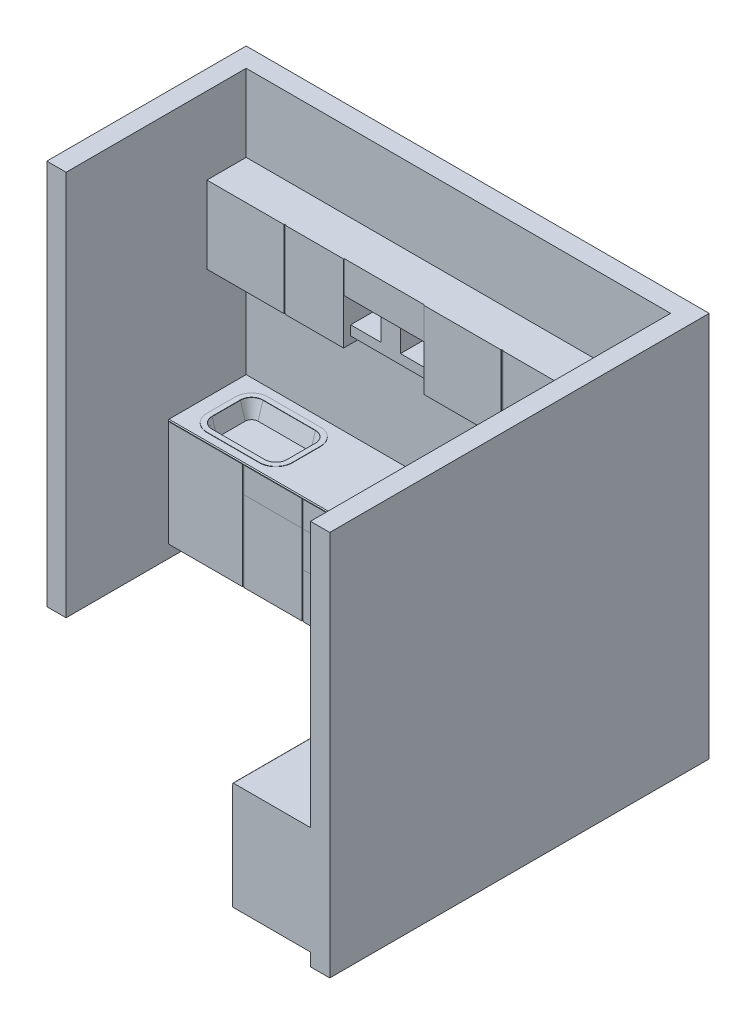
from build123d import *

# Parameters (mm, degrees)
BOSS_EXTRUDE1_DEPTH   = 3048
BOSS_EXTRUDE2_START   = 101.6
BOSS_EXTRUDE2_DEPTH   = 838.2
SKETCH5_W             = 584.2
SKETCH5_H             = 838.2
SKETCH5_W_2           = 457.2
SKETCH5_W_3           = 609.6
SKETCH5_W_4           = 431.8
BOSS_EXTRUDE3_DEPTH   = 5.08
SKETCH10_W            = 457.2
SKETCH10_H            = 838.2
SKETCH10_W_2          = 152.4
SKETCH10_W_3          = 596.9
SKETCH10_W_4          = 515.62
BOSS_EXTRUDE4_DEPTH   = 5.08
BOSS_EXTRUDE5_START   = 1828.8
BOSS_EXTRUDE5_DEPTH   = 609.6
SKETCH12_W            = 609.6
SKETCH12_H            = 609.6
SKETCH12_W_2          = 457.2
SKETCH12_W_3          = 711.2
BOSS_EXTRUDE6_DEPTH   = 5.08
SKETCH13_W            = 635
SKETCH13_H            = 356.096937619
CUT_EXTRUDE2_DEPTH    = 304.8
BOSS_EXTRUDE7_DEPTH   = 254
SKETCH15_W            = 304.8
SKETCH15_H            = 609.6
CUT_EXTRUDE3_DEPTH    = 2844.8
SKETCH16_W            = 609.6
SKETCH16_H            = 609.6
CUT_EXTRUDE4_DEPTH    = 2844.8
BOSS_EXTRUDE8_REACH   = 3432.787
SKETCH17_W            = 609.6
SKETCH17_H            = 457.2
SKETCH18_W            = 558.8
SKETCH18_H            = 1435.1
CUT_EXTRUDE5_DEPTH    = 406.4
SKETCH19_W            = 558.8
SKETCH19_H            = 2.54
EXTRUDE_THIN1_DEPTH   = 355.6
EXTRUDE_THIN1_2_DEPTH = 355.6
BOSS_EXTRUDE9_START   = 25.4
SKETCH20_W            = 558.8
SKETCH20_H            = 1435.1
BOSS_EXTRUDE9_DEPTH   = 25.4
CUT_EXTRUDE6_DEPTH    = 124.46
CUT_EXTRUDE6_DRAFT    = -17
BOSS_EXTRUDE10_DEPTH  = 2.54


with BuildPart() as part:
    # Sketch1 → Boss-Extrude1 (new body)
    with BuildSketch(Plane(origin=(0, 0, 0), x_dir=(1, 0, 0), z_dir=(0, 1, 0))):
        Polygon((-1828.8, 0), (-1828.8, 1574.8), (1828.8, 1574.8), (1828.8, -1422.4), (1676.4, -1422.4), (1676.4, 1422.4), (-1676.4, 1422.4), (-1676.4, 0), align=None)
    extrude(amount=BOSS_EXTRUDE1_DEPTH)



with BuildPart() as body_2:
    # Sketch2 → Boss-Extrude2 (new body)
    with BuildSketch(Plane(origin=(0, 0, 0), x_dir=(1, 0, 0), z_dir=(0, 1, 0)).offset(BOSS_EXTRUDE2_START)):
        Polygon((1676.4, 1422.4), (1676.4, -1422.4), (1066.8, -1422.4), (1066.8, 812.8), (-1676.4, 812.8), (-1676.4, 1422.4), align=None)
    extrude(amount=BOSS_EXTRUDE2_DEPTH)


with BuildPart() as part_1:
    add(part.part)

    add(body_2.part)  # Sweep2 merges body 2
    # Sweep2: sweep along a path in Sketch3
    with BuildLine(Plane(origin=(0, 939.8, 0), x_dir=(1, 0, 0), z_dir=(0, 1, 0))) as sweep2_path:
        Line((1066.8, -1422.4), (1066.8, 812.8))
        Line((1066.8, 812.8), (-1676.4, 812.8))
    # Sketch4 → Sweep2 (sweep)
    with BuildSketch(Plane.XY.offset(1422.4)):
        with BuildLine():
            Line((1676.4, 939.8), (1066.8, 939.8))
            ThreePointArc((1066.8, 939.8), (1062.043473448, 946.15), (1066.8, 952.5))
            Line((1066.8, 952.5), (1676.4, 952.5))
            Line((1676.4, 952.5), (1676.4, 939.8))
        make_face()
    sweep(path=sweep2_path.line, transition=Transition.RIGHT)

    # Sketch5 → Boss-Extrude3 (add)
    with BuildSketch(Plane.XY.offset(-812.8)):
        with Locations((-1384.3, 520.7)):
            Rectangle(SKETCH5_W, SKETCH5_H)
        with Locations((-850.9, 520.7)):
            Rectangle(SKETCH5_W_2, SKETCH5_H)
        with Locations((-304.8, 520.7)):
            Rectangle(SKETCH5_W_3, SKETCH5_H)
        with Locations((762, 520.7)):
            Rectangle(SKETCH5_W_3, SKETCH5_H)
        with Locations((228.6, 520.7)):
            Rectangle(SKETCH5_W_4, SKETCH5_H)
    extrude(amount=BOSS_EXTRUDE3_DEPTH)

    # Sketch10 → Boss-Extrude4 (add)
    with BuildSketch(Plane.ZY.offset(-1066.8)):
        with Locations((-579.12, 520.7)):
            Rectangle(SKETCH10_W, SKETCH10_H)
        with Locations((-261.62, 520.7)):
            Rectangle(SKETCH10_W_2, SKETCH10_H)
        with Locations((125.73, 520.7)):
            Rectangle(SKETCH10_W_3, SKETCH10_H)
        with Locations((1164.59, 520.7)):
            Rectangle(SKETCH10_W_4, SKETCH10_H)
        with Locations((665.48, 520.7)):
            Rectangle(SKETCH10_W, SKETCH10_H)
    extrude(amount=BOSS_EXTRUDE4_DEPTH)

    # Sketch11 → Boss-Extrude5 (add)
    with BuildSketch(Plane(origin=(0, 0, 0), x_dir=(1, 0, 0), z_dir=(0, 1, 0)).offset(BOSS_EXTRUDE5_START)):
        Polygon((1676.4, 1422.4), (1676.4, -1422.4), (1371.6, -1422.4), (1371.6, 1117.6), (-1676.4, 1117.6), (-1676.4, 1422.4), align=None)
    extrude(amount=BOSS_EXTRUDE5_DEPTH)

    # Sketch12 → Boss-Extrude6 (add)
    with BuildSketch(Plane.XY.offset(-1117.6)):
        with Locations((-1371.6, 2133.6)):
            Rectangle(SKETCH12_W, SKETCH12_H)
        with Locations((-825.5, 2133.6)):
            Rectangle(SKETCH12_W_2, SKETCH12_H)
        with Locations((342.9, 2133.6)):
            Rectangle(SKETCH12_W, SKETCH12_H)
        with Locations((1016, 2133.6)):
            Rectangle(SKETCH12_W_3, SKETCH12_H)
    extrude(amount=BOSS_EXTRUDE6_DEPTH)

    # Sketch13 → Cut-Extrude2 (cut)
    with BuildSketch(Plane.XY.offset(-1117.6)):
        with Locations((-279.4, 2006.84846881)):
            Rectangle(SKETCH13_W, SKETCH13_H)
    extrude(amount=-CUT_EXTRUDE2_DEPTH, mode=Mode.SUBTRACT)

    # Sketch15 → Cut-Extrude3 (cut)
    with BuildSketch(Plane.XY.offset(1422.4)):
        with Locations((1524, 2133.6)):
            Rectangle(SKETCH15_W, SKETCH15_H)
    extrude(amount=-CUT_EXTRUDE3_DEPTH, mode=Mode.SUBTRACT)

    # Sketch16 → Cut-Extrude4 (cut)
    with BuildSketch(Plane(origin=(0, 952.5, 0), x_dir=(1, 0, 0), z_dir=(0, 1, 0))):
        with Locations((1371.6, 1117.6)):
            Rectangle(SKETCH16_W, SKETCH16_H)
    extrude(amount=CUT_EXTRUDE4_DEPTH, mode=Mode.SUBTRACT)


with BuildPart() as body_2_2:
    # Sketch14 → Boss-Extrude7 (new body)
    with BuildSketch(Plane.XY.offset(-1422.4)):
        Polygon((-355.6, 2184.896937619), (-203.2, 2184.896937619), (-203.2, 1959.906980292), (38.1, 1959.906980292), (38.1, 1883.706980292), (-596.9, 1883.706980292), (-596.9, 1959.906980292), (-355.6, 1959.906980292), align=None)
    extrude(amount=BOSS_EXTRUDE7_DEPTH)


with BuildPart() as body_3:

    # Sketch17 → Boss-Extrude8 (new, up to next)
    with BuildSketch(Plane(origin=(0, 2438.4, 0), x_dir=(1, 0, 0), z_dir=(0, 1, 0)), mode=Mode.PRIVATE) as boss_extrude8_sk1:
        with Locations((1371.6, 1193.8)):
            Rectangle(SKETCH17_W, SKETCH17_H)
    boss_extrude8_tool1 = extrude(boss_extrude8_sk1.sketch, amount=-BOSS_EXTRUDE8_REACH, mode=Mode.PRIVATE) - part_1.part
    add(boss_extrude8_tool1.solids().sort_by_distance((1371.6, 2438.4, -1193.8))[0])

    # Sketch18 → Cut-Extrude5 (cut)
    with BuildSketch(Plane.XY.offset(-965.2)):
        with Locations((1371.6, 1695.45)):
            Rectangle(SKETCH18_W, SKETCH18_H)
    extrude(amount=-CUT_EXTRUDE5_DEPTH, mode=Mode.SUBTRACT)


with BuildPart() as body_4:
    # Sketch19 → Extrude-Thin1 (new body)
    with BuildSketch(Plane.XY.offset(-1371.6)):
        with Locations((1371.6, 1694.18)):
            Rectangle(SKETCH19_W, SKETCH19_H)
    extrude(amount=EXTRUDE_THIN1_DEPTH)


with BuildPart() as body_5:
    # Sketch19 → Extrude-Thin1 2 (new body)
    with BuildSketch(Plane.XY.offset(-1371.6)):
        with Locations((1371.6, 1377.976430218)):
            Rectangle(SKETCH19_W, SKETCH19_H)
    extrude(amount=EXTRUDE_THIN1_2_DEPTH)


with BuildPart() as body_6:
    # Sketch20 → Boss-Extrude9 (new body)
    with BuildSketch(Plane.XY.offset(-1016).offset(BOSS_EXTRUDE9_START)):
        with Locations((1371.6, 1695.45)):
            Rectangle(SKETCH20_W, SKETCH20_H)
    extrude(amount=BOSS_EXTRUDE9_DEPTH)


with BuildPart() as cut_extrude6_tool:
    # Sketch21 → Cut-Extrude6 (with draft: the straight prism first)
    with BuildSketch(Plane(origin=(0, 952.5, 0), x_dir=(1, 0, 0), z_dir=(0, 1, 0))):
        with BuildLine():
            Line((-1434.983537016, 911.965361051), (-1020.269732089, 911.965361051))
            ThreePointArc((-1020.269732089, 911.965361051), (-957.407939242, 938.003568204), (-931.369732089, 1000.865361051))
            Line((-931.369732089, 1000.865361051), (-931.369732089, 1224.174638949))
            ThreePointArc((-931.369732089, 1224.174638949), (-957.407939242, 1287.036431796), (-1020.269732089, 1313.074638949))
            Line((-1020.269732089, 1313.074638949), (-1434.983537016, 1313.074638949))
            ThreePointArc((-1434.983537016, 1313.074638949), (-1497.845329863, 1287.036431796), (-1523.883537016, 1224.174638949))
            Line((-1523.883537016, 1224.174638949), (-1523.883537016, 1000.865361051))
            ThreePointArc((-1523.883537016, 1000.865361051), (-1497.845329863, 938.003568204), (-1434.983537016, 911.965361051))
        make_face()
    extrude(amount=-CUT_EXTRUDE6_DEPTH)
    # Cut-Extrude6: the draft: its side faces are tilted about the plane it starts from
    cut_extrude6_sides = [cut_extrude6_tool.faces().sort_by_distance(p)[0] for p in [
        (-1497.845329863, 890.27, -938.003568204),
        (-1227.626634553, 890.27, -911.965361051),
        (-957.407939242, 890.27, -938.003568204),
        (-931.369732089, 890.27, -1112.52),
        (-957.407939242, 890.27, -1287.036431796),
        (-1227.626634553, 890.27, -1313.074638949),
        (-1497.845329863, 890.27, -1287.036431796),
        (-1523.883537016, 890.27, -1112.52),
    ]]
    draft(cut_extrude6_sides, Plane(origin=(0, 952.5, 0), x_dir=(1, 0, 0), z_dir=(0, 1, 0)), CUT_EXTRUDE6_DRAFT)


with BuildPart() as part_2:
    add(part_1.part)

    # Cut-Extrude6: cut by cut_extrude6_tool
    add(cut_extrude6_tool.part, mode=Mode.SUBTRACT)

    # Sketch22 → Boss-Extrude10 (add)
    with BuildSketch(Plane(origin=(0, 952.5, 0), x_dir=(1, 0, 0), z_dir=(0, 1, 0))):
        with BuildLine():
            Line((-1434.983537016, 871.325361051), (-1020.269732089, 871.325361051))
            ThreePointArc((-1020.269732089, 871.325361051), (-928.671119655, 909.266748616), (-890.729732089, 1000.865361051))
            Line((-890.729732089, 1000.865361051), (-890.729732089, 1224.174638949))
            ThreePointArc((-890.729732089, 1224.174638949), (-928.671119655, 1315.773251384), (-1020.269732089, 1353.714638949))
            Line((-1020.269732089, 1353.714638949), (-1434.983537016, 1353.714638949))
            ThreePointArc((-1434.983537016, 1353.714638949), (-1526.582149451, 1315.773251384), (-1564.523537016, 1224.174638949))
            Line((-1564.523537016, 1224.174638949), (-1564.523537016, 1000.865361051))
            ThreePointArc((-1564.523537016, 1000.865361051), (-1526.582149451, 909.266748616), (-1434.983537016, 871.325361051))
        make_face()
        with BuildLine():
            Line((-931.369732089, 1000.865361051), (-931.369732089, 1224.174638949))
            ThreePointArc((-931.369732089, 1224.174638949), (-957.407939242, 1287.036431796), (-1020.269732089, 1313.074638949))
            Line((-1020.269732089, 1313.074638949), (-1434.983537016, 1313.074638949))
            ThreePointArc((-1434.983537016, 1313.074638949), (-1497.845329863, 1287.036431796), (-1523.883537016, 1224.174638949))
            Line((-1523.883537016, 1224.174638949), (-1523.883537016, 1000.865361051))
            ThreePointArc((-1523.883537016, 1000.865361051), (-1497.845329863, 938.003568204), (-1434.983537016, 911.965361051))
            Line((-1434.983537016, 911.965361051), (-1020.269732089, 911.965361051))
            ThreePointArc((-1020.269732089, 911.965361051), (-957.407939242, 938.003568204), (-931.369732089, 1000.865361051))
        make_face(mode=Mode.SUBTRACT)
    extrude(amount=BOSS_EXTRUDE10_DEPTH)


solid = Compound([body_2_2.part, body_3.part, body_4.part, body_5.part, body_6.part, part_2.part])
